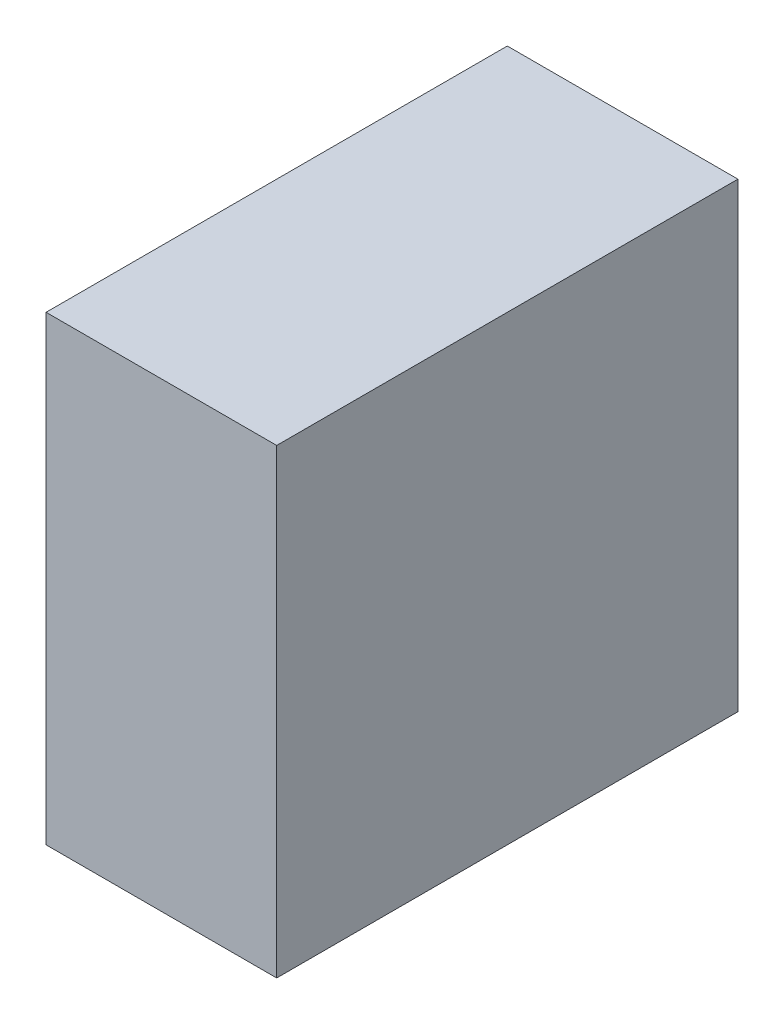
from build123d import *

# Parameters (mm, degrees)
SKETCH1_W           = 25
SKETCH1_H           = 50
BOSS_EXTRUDE1_DEPTH = 50


with BuildPart() as part:
    # Sketch1 → Boss-Extrude1 (new body)
    with BuildSketch(Plane.XY):
        Rectangle(SKETCH1_W, SKETCH1_H)
    extrude(amount=BOSS_EXTRUDE1_DEPTH)


solid = part.part
